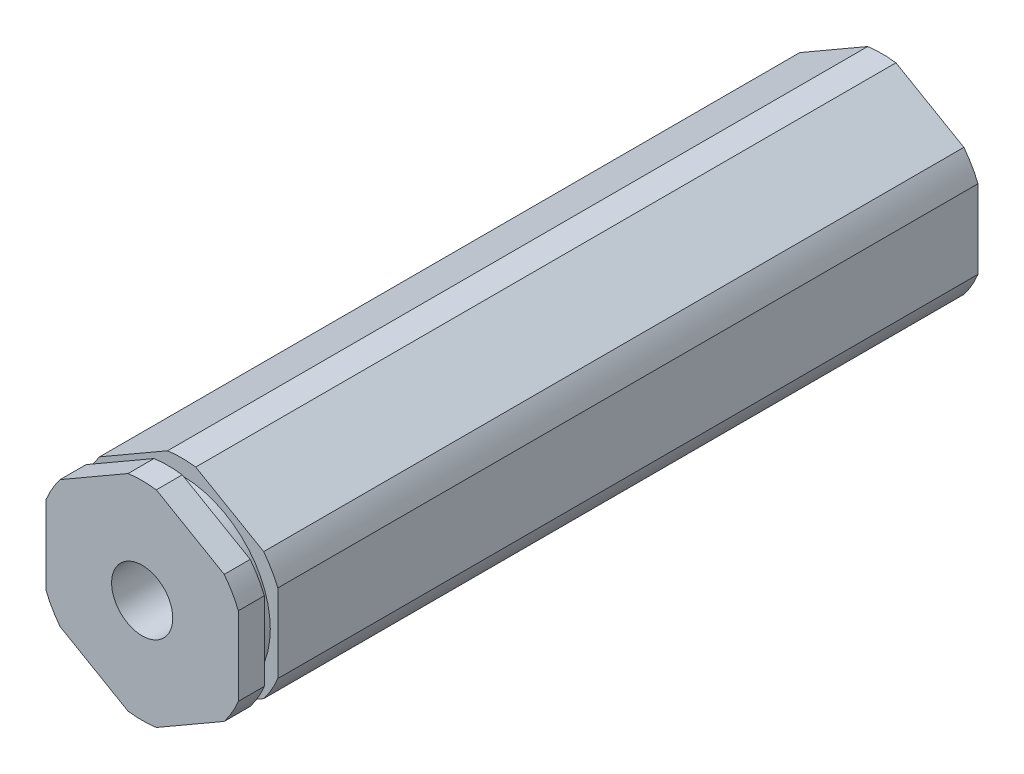
from build123d import *

# Parameters (mm, degrees)
BOSS_EXTRUDE1_DEPTH                  = 24.41575
F_10_32_TAPPED_HOLE1_D               = 4.0386
F_10_32_TAPPED_HOLE1_DEPTH           = 16.34744
F_10_32_TAPPED_HOLE1_TIP             = 1.213317848
F_10_32_TAPPED_HOLE1_ON_FACE_2_D     = 4.0386
F_10_32_TAPPED_HOLE1_ON_FACE_2_DEPTH = 16.34744
F_10_32_TAPPED_HOLE1_ON_FACE_2_TIP   = 1.213317848
SKETCH5_W                            = 0.889
SKETCH5_H                            = 1.0033


with BuildPart() as part:
    # Sketch1 → Boss-Extrude1 (new, symmetric)
    with BuildSketch(Plane.XY):
        with BuildLine():
            ThreePointArc((0.93173274, 6.79441227), (0, 6.858), (-0.93173274, 6.79441227))
            Line((-0.93173274, 6.79441227), (-5.41826726, 4.204110358))
            ThreePointArc((-5.41826726, 4.204110358), (-5.939202219, 3.429), (-6.35, 2.590301913))
            Line((-6.35, 2.590301913), (-6.35, -2.590301913))
            ThreePointArc((-6.35, -2.590301913), (-5.939202219, -3.429), (-5.41826726, -4.204110358))
            Line((-5.41826726, -4.204110358), (-0.93173274, -6.79441227))
            ThreePointArc((-0.93173274, -6.79441227), (0, -6.858), (0.93173274, -6.79441227))
            Line((0.93173274, -6.79441227), (5.41826726, -4.204110358))
            ThreePointArc((5.41826726, -4.204110358), (5.939202219, -3.429), (6.35, -2.590301913))
            Line((6.35, -2.590301913), (6.35, 2.590301913))
            ThreePointArc((6.35, 2.590301913), (5.939202219, 3.429), (5.41826726, 4.204110358))
            Line((5.41826726, 4.204110358), (0.93173274, 6.79441227))
        make_face()
    extrude(amount=BOSS_EXTRUDE1_DEPTH, both=True)

    # #10-32 Tapped Hole1
    with Locations(Plane.XY.offset(24.41575)):
        with Locations((0, 0)):
            Hole(F_10_32_TAPPED_HOLE1_D / 2, depth=F_10_32_TAPPED_HOLE1_DEPTH)
            with Locations((0, 0, -(F_10_32_TAPPED_HOLE1_DEPTH + F_10_32_TAPPED_HOLE1_TIP / 2))):  # 118° drill point
                Cone(0, F_10_32_TAPPED_HOLE1_D / 2, F_10_32_TAPPED_HOLE1_TIP, mode=Mode.SUBTRACT)

    # #10-32 Tapped Hole1 on face 2
    with Locations(Plane(origin=(0, 0, -24.41575), x_dir=(-1, 0, 0), z_dir=(0, 0, -1))):
        with Locations((0, 0)):
            Hole(F_10_32_TAPPED_HOLE1_ON_FACE_2_D / 2, depth=F_10_32_TAPPED_HOLE1_ON_FACE_2_DEPTH)
            with Locations((0, 0, -(F_10_32_TAPPED_HOLE1_ON_FACE_2_DEPTH + F_10_32_TAPPED_HOLE1_ON_FACE_2_TIP / 2))):  # 118° drill point
                Cone(0, F_10_32_TAPPED_HOLE1_ON_FACE_2_D / 2, F_10_32_TAPPED_HOLE1_ON_FACE_2_TIP, mode=Mode.SUBTRACT)

    # Sketch5 → Cut-Revolve1 (revolve, cut)
    with BuildSketch(Plane(origin=(0, 0, 0), x_dir=(0, 0, -1), z_dir=(1, 0, 0)), mode=Mode.PRIVATE) as cut_revolve1_sk:
        with Locations((-22.25675, 6.35635)):
            Rectangle(SKETCH5_W, SKETCH5_H)
    revolve(cut_revolve1_sk.sketch.rotate(Axis((0, 0, 165.047176272), (0, 0, -1)), 90), axis=Axis((0, 0, 165.047176272), (0, 0, -1)), mode=Mode.SUBTRACT)


solid = part.part
